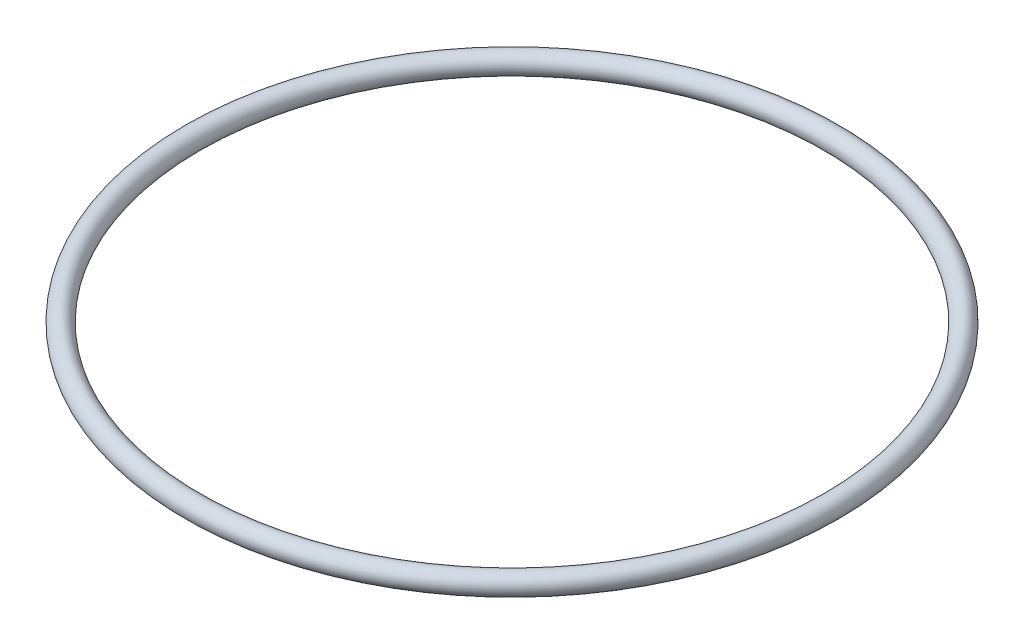
from build123d import *

# Parameters (mm, degrees)
SKETCH_2_R = 1.5


with BuildPart() as part:
    # 扫描1: sweep along a path in 草图1
    with BuildLine(Plane(origin=(0, 0, 0), x_dir=(1, 0, 0), z_dir=(0, 1, 0))) as sweep_1_path:
        CenterArc((0, 0), 46.25, 0, 360)
    # 草图2 → 扫描1 (sweep)
    with BuildSketch(Plane.XY):
        with Locations((46.25, 0)):
            Circle(SKETCH_2_R)
    sweep(path=sweep_1_path.line)


solid = part.part
